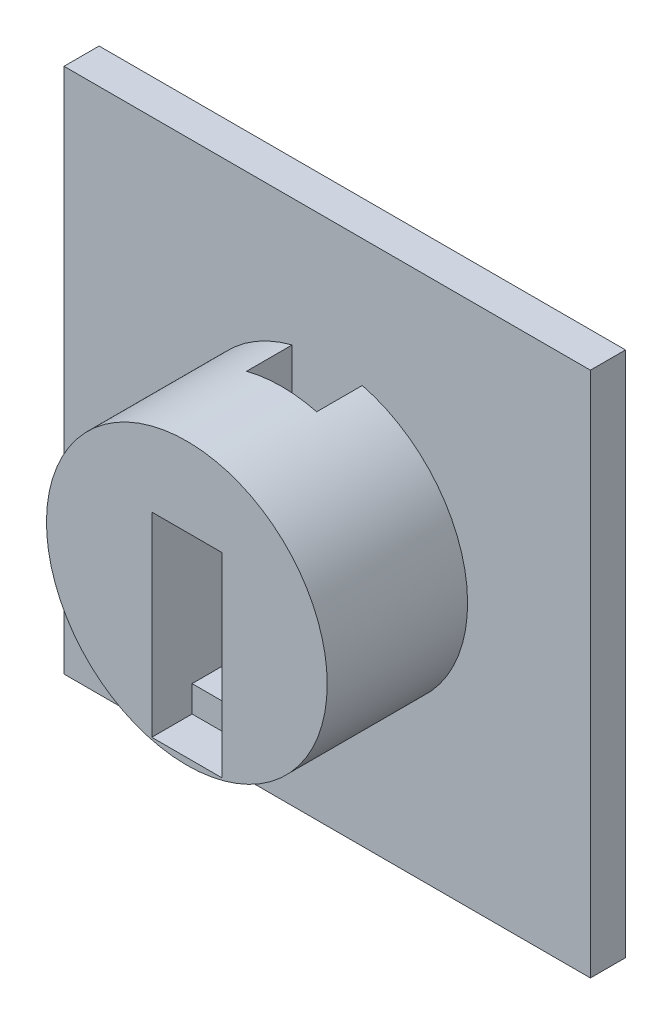
from build123d import *

# Parameters (mm, degrees)
CROQUIS1_W              = 150
CROQUIS1_H              = 150
SALIENTE_EXTRUIR1_DEPTH = 10
CROQUIS2_R              = 40
SALIENTE_EXTRUIR2_DEPTH = 40
CORTAR_EXTRUIR1_DEPTH   = 41
CROQUIS4_W              = 20
CROQUIS4_H              = 7.5
CORTAR_EXTRUIR2_DEPTH   = 11.5
CORTAR_EXTRUIR3_START   = -27
CROQUIS5_W              = 20
CROQUIS5_H              = 34.531245334
CORTAR_EXTRUIR3_DEPTH   = 13


with BuildPart() as part:
    # Croquis1 → Saliente-Extruir1 (new body)
    with BuildSketch(Plane(origin=(0, 0, 0), x_dir=(0, 1, 0), z_dir=(0, 0, 1))):
        Rectangle(CROQUIS1_W, CROQUIS1_H)
    extrude(amount=SALIENTE_EXTRUIR1_DEPTH)

    # Croquis2 → Saliente-Extruir2 (add)
    with BuildSketch(Plane.XY.offset(10)):
        Circle(CROQUIS2_R)
    extrude(amount=SALIENTE_EXTRUIR2_DEPTH)

    # Croquis3 → Cortar-Extruir1 (cut)
    with BuildSketch(Plane.XY.offset(50)):
        Polygon((0, 10), (-10, 10), (-10, -30.6), (10, -30.6), (10, 10), align=None)
    extrude(amount=-CORTAR_EXTRUIR1_DEPTH, mode=Mode.SUBTRACT)

    # Croquis4 → Cortar-Extruir2 (cut)
    with BuildSketch(Plane.XY.offset(50)):
        with Locations((0, -34.35)):
            Rectangle(CROQUIS4_W, CROQUIS4_H)
        with Locations((0, 13.75)):
            Rectangle(CROQUIS4_W, CROQUIS4_H)
    extrude(amount=-CORTAR_EXTRUIR2_DEPTH, mode=Mode.SUBTRACT)

    # Croquis5 → Cortar-Extruir3 (cut)
    with BuildSketch(Plane.XY.offset(50).offset(CORTAR_EXTRUIR3_START)):
        with Locations((0, 27.265622667)):
            Rectangle(CROQUIS5_W, CROQUIS5_H)
    extrude(amount=-CORTAR_EXTRUIR3_DEPTH, mode=Mode.SUBTRACT)


solid = part.part
